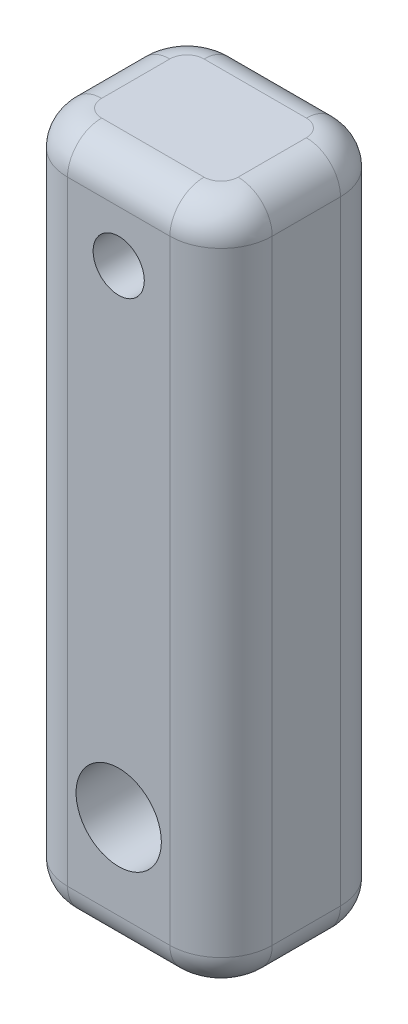
from build123d import *

# Parameters (mm, degrees)
BOSS_EXTRUDE1_DEPTH = 101.6
SKETCH2_R           = 6.35
CUT_EXTRUDE1_DEPTH  = 106.829946612
SKETCH3_R           = 3.81
CUT_EXTRUDE2_DEPTH  = 106.829946612
FILLET1_R           = 5.08
FILLET2_R           = 5.08


with BuildPart() as part:
    # Sketch1 → Boss-Extrude1 (new body)
    with BuildSketch(Plane(origin=(0, 0, 0), x_dir=(1, 0, 0), z_dir=(0, 1, 0))):
        with BuildLine():
            Line((-7.62, 12.7), (7.62, 12.7))
            ThreePointArc((7.62, 12.7), (13.008153673, 10.468153673), (15.24, 5.08))
            Line((15.24, 5.08), (15.24, -5.08))
            ThreePointArc((15.24, -5.08), (13.008153673, -10.468153673), (7.62, -12.7))
            Line((7.62, -12.7), (-7.62, -12.7))
            ThreePointArc((-7.62, -12.7), (-13.008153673, -10.468153673), (-15.24, -5.08))
            Line((-15.24, -5.08), (-15.24, 5.08))
            ThreePointArc((-15.24, 5.08), (-13.008153673, 10.468153673), (-7.62, 12.7))
        make_face()
    extrude(amount=BOSS_EXTRUDE1_DEPTH)

    # Sketch2 → Cut-Extrude1 (cut, through all)
    with BuildSketch(Plane.XY.offset(12.7)):
        with Locations((0, 17.78)):
            Circle(SKETCH2_R)
    extrude(amount=-CUT_EXTRUDE1_DEPTH, mode=Mode.SUBTRACT)

    # Sketch3 → Cut-Extrude2 (cut, through all)
    with BuildSketch(Plane.XY.offset(12.7)):
        with Locations((0, 88.9)):
            Circle(SKETCH3_R)
    extrude(amount=-CUT_EXTRUDE2_DEPTH, mode=Mode.SUBTRACT)

    # Fillet1
    fillet1_edges = [part.edges().sort_by_distance(p)[0] for p in [
        (0, 0, 12.7),
        (-13.008153673, 0, 10.468153673),
        (-15.24, 0, 0),
        (-13.008153673, 0, -10.468153673),
        (0, 0, -12.7),
        (13.008153673, 0, -10.468153673),
        (15.24, 0, 0),
        (13.008153673, 0, 10.468153673),
    ]]
    fillet(fillet1_edges, radius=FILLET1_R)

    # Fillet2
    fillet2_edges = [part.edges().sort_by_distance(p)[0] for p in [
        (13.008153673, 101.6, 10.468153673),
        (15.24, 101.6, 0),
        (13.008153673, 101.6, -10.468153673),
        (0, 101.6, -12.7),
        (-13.008153673, 101.6, -10.468153673),
        (-15.24, 101.6, 0),
        (-13.008153673, 101.6, 10.468153673),
        (0, 101.6, 12.7),
    ]]
    fillet(fillet2_edges, radius=FILLET2_R)


solid = part.part
